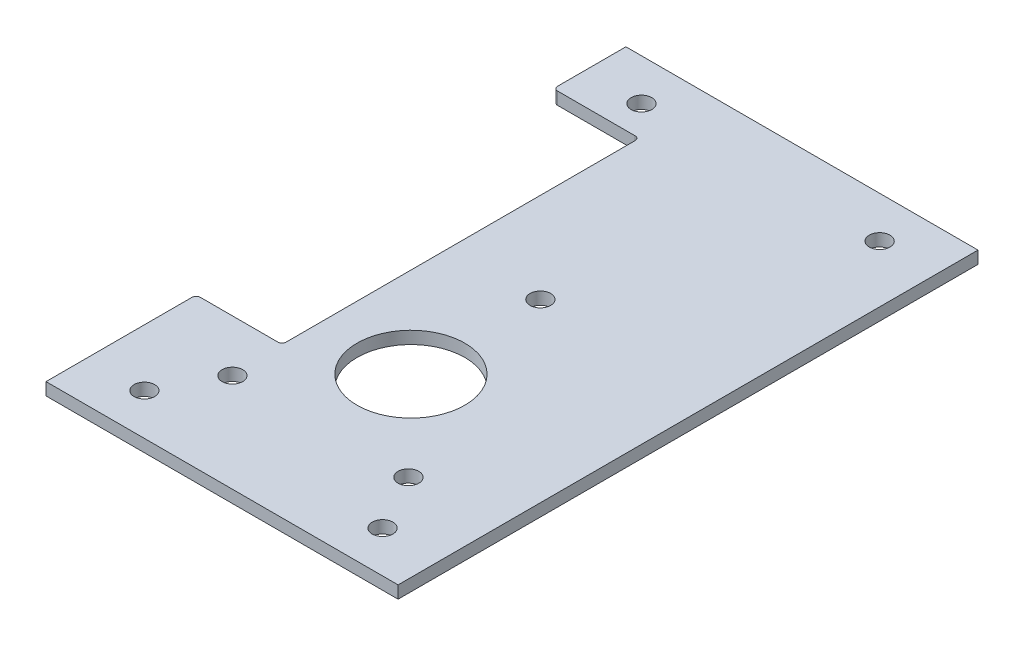
from build123d import *

# Parameters (mm, degrees)
SKETCH1_W           = 170
SKETCH1_H           = 280
BOSS_EXTRUDE1_DEPTH = 6
SKETCH2_R           = 5
CUT_EXTRUDE1_DEPTH  = 6
SKETCH3_W           = 41.455389413
SKETCH3_H           = 172.5
CUT_EXTRUDE2_DEPTH  = 10
FILLET1_R           = 2
SKETCH4_R           = 26
CUT_EXTRUDE3_DEPTH  = 10


with BuildPart() as part:
    # Sketch1 → Boss-Extrude1 (new body)
    with BuildSketch(Plane(origin=(0, 0, 0), x_dir=(1, 0, 0), z_dir=(0, 1, 0))):
        Rectangle(SKETCH1_W, SKETCH1_H)
    extrude(amount=BOSS_EXTRUDE1_DEPTH)

    # Sketch2 → Cut-Extrude1 (cut)
    with BuildSketch(Plane(origin=(0, 6, 0), x_dir=(1, 0, 0), z_dir=(0, 1, 0))):
        with Locations(Location((-57.5, 120, 0), (0, 0, 270))):
            Circle(SKETCH2_R)
        with Locations(Location((57.5, 120, 0), (0, 0, 270))):
            Circle(SKETCH2_R)
        with Locations(Location((0, 13.7, 0), (0, 0, 270))):
            Circle(SKETCH2_R)
        with Locations(Location((-57.5, -120, 0), (0, 0, 270))):
            Circle(SKETCH2_R)
        with Locations(Location((57.5, -120, 0), (0, 0, 270))):
            Circle(SKETCH2_R)
        with Locations(Location((-42.5, -92.5, 0), (0, 0, 270))):
            Circle(SKETCH2_R)
        with Locations(Location((42.5, -92.5, 0), (0, 0, 270))):
            Circle(SKETCH2_R)
    extrude(amount=-CUT_EXTRUDE1_DEPTH, mode=Mode.SUBTRACT)

    # Sketch3 → Cut-Extrude2 (cut)
    with BuildSketch(Plane(origin=(0, 6, 0), x_dir=(1, 0, 0), z_dir=(0, 1, 0))):
        with Locations((-64.272305293, 18.75)):
            Rectangle(SKETCH3_W, SKETCH3_H)
    extrude(amount=-CUT_EXTRUDE2_DEPTH, mode=Mode.SUBTRACT)

    # Fillet1
    fillet1_edges = [part.edges().sort_by_distance(p)[0] for p in [
        (-43.544610587, 3, -105),
        (-43.544610587, 3, 67.5),
        (-85, 3, 67.5),
        (-85, 3, -105),
    ]]
    fillet(fillet1_edges, radius=FILLET1_R)

    # Sketch4 → Cut-Extrude3 (cut)
    with BuildSketch(Plane(origin=(0, 6, 0), x_dir=(1, 0, 0), z_dir=(0, 1, 0))):
        with Locations(Location((0, -48.8, 0), (0, 0, 270))):
            Circle(SKETCH4_R)
    extrude(amount=-CUT_EXTRUDE3_DEPTH, mode=Mode.SUBTRACT)


solid = part.part
